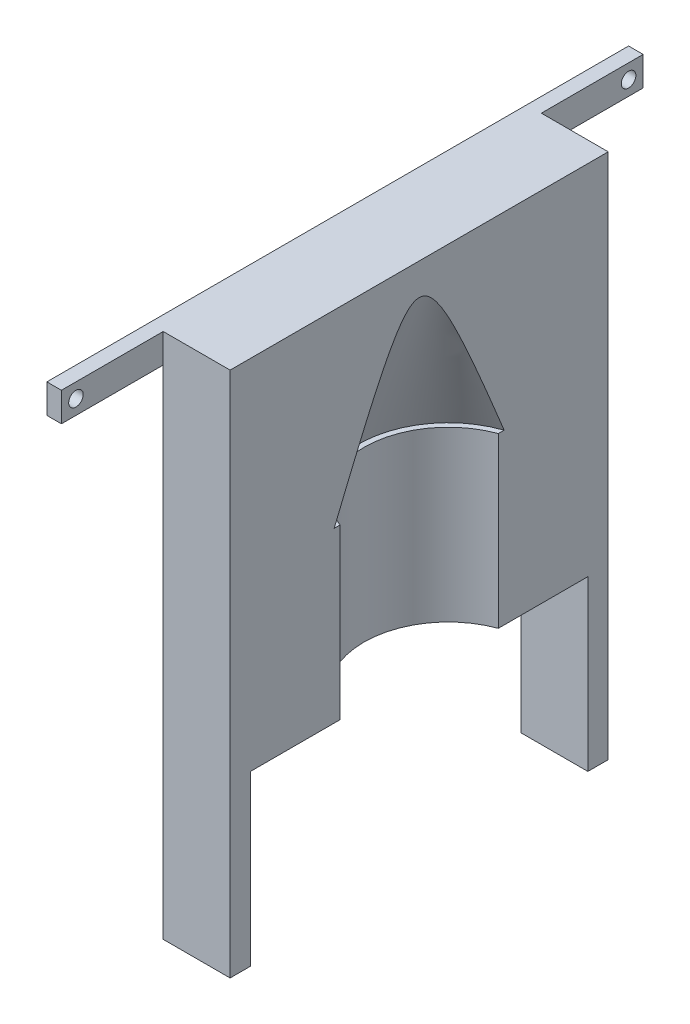
from build123d import *

# Parameters (mm, degrees)
ESQUISSE1_W             = 130
ESQUISSE1_H             = 181
BASE_DEPTH              = 23
ESQUISSE2_W             = 116
ESQUISSE2_H             = 58
VIDE_CUBE_DEPTH         = 114.772799913
ESQUISSE3_R             = 29
VIDE_CYLINDRE_DEPTH     = 58
ESQUISSE5_W             = 5
ESQUISSE5_H             = 200
FIXATION_TIGE_DEPTH     = 10
ESQUISSE6_R             = 2.5
ENL_V_MAT_EXTRU_1_DEPTH = 137.818310178


with BuildPart() as part:
    # Esquisse1 → BASE (new body)
    with BuildSketch(Plane(origin=(0, 0, 0), x_dir=(0, 0, -1), z_dir=(1, 0, 0))):
        Rectangle(ESQUISSE1_W, ESQUISSE1_H)
    extrude(amount=BASE_DEPTH)

    # Esquisse2 → VIDE CUBE (cut, through all)
    with BuildSketch(Plane(origin=(23, 0, 0), x_dir=(0, 0, -1), z_dir=(1, 0, 0))):
        with Locations((0, -61.5)):
            Rectangle(ESQUISSE2_W, ESQUISSE2_H)
    extrude(amount=-VIDE_CUBE_DEPTH, mode=Mode.SUBTRACT)

    # Esquisse3 → VIDE CYLINDRE (cut)
    with BuildSketch(Plane.XZ.offset(32.5)):
        with Locations((33, 0)):
            Circle(ESQUISSE3_R)
    extrude(amount=-VIDE_CYLINDRE_DEPTH, mode=Mode.SUBTRACT)

    # Esquisse4 → VIDE CONE (revolve, cut)
    with BuildSketch(Plane(origin=(33, 0, 0), x_dir=(0, 0, -1), z_dir=(1, 0, 0))):
        Polygon((0, 25.5), (30.88316048, 25.5), (0, 105.5), align=None)
    revolve(axis=Axis((33, 105.5, 0), (0, -1, 0)), mode=Mode.SUBTRACT)

    # Esquisse5 → FIXATION TIGE (add)
    with BuildSketch(Plane(origin=(0, 90.5, 0), x_dir=(1, 0, 0), z_dir=(0, 1, 0))):
        with Locations((-2.5, 0)):
            Rectangle(ESQUISSE5_W, ESQUISSE5_H)
    extrude(amount=-FIXATION_TIGE_DEPTH)

    # Esquisse6 → Enlèv. mat.-Extru.1 (cut, through all)
    with BuildSketch(Plane(origin=(0, 0, 0), x_dir=(0, 0, -1), z_dir=(1, 0, 0))):
        with Locations((-95, 85.5)):
            Circle(ESQUISSE6_R)
        with Locations((95, 85.5)):
            Circle(ESQUISSE6_R)
    extrude(amount=-ENL_V_MAT_EXTRU_1_DEPTH, mode=Mode.SUBTRACT)


solid = part.part
